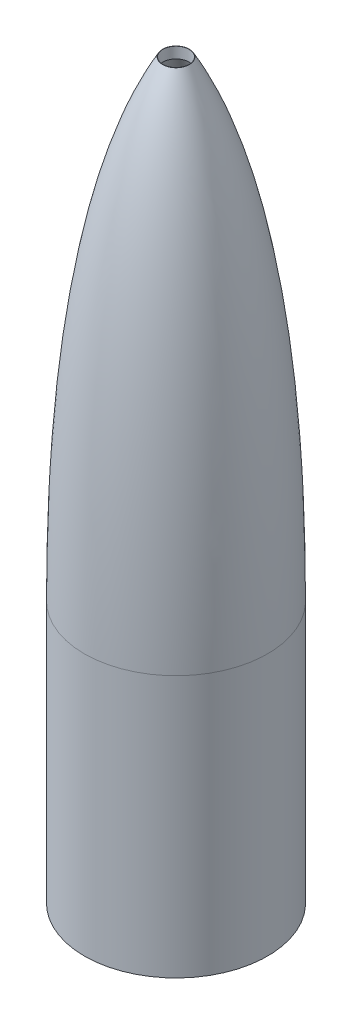
from build123d import *

# Parameters (mm, degrees)
SCHIZZO1_R                    = 17.5
ESTRUSIONE_ESTRUSIONE1_DEPTH  = 50
TAGLIO_ESTRUSIONE1_REACH      = 144.171
SCHIZZO10_R                   = 16.3
TAGLIO_ESTRUSIONE3_DEPTH      = 143.170672106
TAGLIO_ESTRUSIONE3_DEPTH_BACK = 143.170672106
SCHIZZO14_R                   = 2.5
SKETCH1_R                     = 16.3
SKETCH1_R_2                   = 14.8
BOSS_EXTRUDE3_DEPTH           = 15
BOSS_EXTRUDE4_DEPTH           = 5


with BuildPart() as part:
    # Schizzo1 → Estrusione-Estrusione1 (new body)
    with BuildSketch(Plane(origin=(0, 0, 0), x_dir=(1, 0, 0), z_dir=(0, 1, 0))):
        with Locations(Location((0, 0, 0), (0, 0, 270))):
            Circle(SCHIZZO1_R)
    extrude(amount=ESTRUSIONE_ESTRUSIONE1_DEPTH)

    # Schizzo7 → Rivoluzione1 (revolve)
    with BuildSketch(Plane.XY):
        with BuildLine():
            Line((0, 140), (-2.55, 140))
            add(Edge.make_bspline(
                [(-2.55, 140), (-17.5, 113.62789219), (-17.5, 50)],
                knots=[0, 0, 0, 1, 1, 1], degree=2))
            Line((-17.5, 50), (-16.3, 50))
            add(Edge.make_bspline(
                [(-2, 138.8), (-16.3, 113.62789219), (-16.3, 50)],
                knots=[0, 0, 0, 1, 1, 1], degree=2))
            Line((-2, 138.8), (0, 138.8))
            Line((0, 138.8), (0, 140))
        make_face()
    revolve(axis=Axis((0, 50, 0), (0, 1, 0)))

    # Schizzo10 → Taglio-Estrusione1 (cut, up to next)
    with BuildSketch(Plane(origin=(0, 0, 0), x_dir=(1, 0, 0), z_dir=(0, 1, 0)), mode=Mode.PRIVATE) as taglio_estrusione1_sk1:
        with Locations(Location((0, 0, 0), (0, 0, 90))):
            Circle(SCHIZZO10_R)
    taglio_estrusione1_tool1 = extrude(taglio_estrusione1_sk1.sketch, amount=TAGLIO_ESTRUSIONE1_REACH, mode=Mode.PRIVATE) & part.part
    add(taglio_estrusione1_tool1.solids().sort_by_distance((0, 0, 0))[0], mode=Mode.SUBTRACT)

    # Schizzo14 → Taglio-Estrusione3 (cut, two sides: drawn at the far end of the back side and taken through both)
    with BuildSketch(Plane(origin=(0, 140, 0), x_dir=(1, 0, 0), z_dir=(0, 1, 0)).offset(-TAGLIO_ESTRUSIONE3_DEPTH_BACK)):
        with Locations(Location((0, 0, 0), (0, 0, 90))):
            Circle(SCHIZZO14_R)
    extrude(amount=TAGLIO_ESTRUSIONE3_DEPTH + TAGLIO_ESTRUSIONE3_DEPTH_BACK, mode=Mode.SUBTRACT)

    # Sketch1 → Boss-Extrude3 (add)
    with BuildSketch(Plane.XZ):
        with Locations(Location((0, 0, 0), (0, 0, 270))):
            Circle(SKETCH1_R)
        with Locations(Location((0, 0, 0), (0, 0, 270))):
            Circle(SKETCH1_R_2, mode=Mode.SUBTRACT)
    extrude(amount=-BOSS_EXTRUDE3_DEPTH)

    # Sketch2 → Boss-Extrude4 (add)
    with BuildSketch(Plane.XZ):
        with BuildLine():
            ThreePointArc((-14.8, 0), (-14.688451314, -1.813669762), (-14.355486756, -3.6))
            Line((-14.355486756, -3.6), (-10.845070423, -3.6))
            ThreePointArc((-10.845070423, -3.6), (-8.29948601, -2.545584412), (-7.245070423, 0))
            Line((-7.245070423, 0), (-8.645070423, 0))
            ThreePointArc((-8.645070423, 0), (-10.845070423, -2.2), (-13.045070423, 0))
            Line((-13.045070423, 0), (-14.8, 0))
        make_face()
        with BuildLine():
            Line((-10.845070423, 3.6), (-14.355486756, 3.6))
            ThreePointArc((-14.355486756, 3.6), (-14.688451314, 1.813669762), (-14.8, 0))
            Line((-14.8, 0), (-13.045070423, 0))
            ThreePointArc((-13.045070423, 0), (-10.845070423, 2.2), (-8.645070423, 0))
            Line((-8.645070423, 0), (-7.245070423, 0))
            ThreePointArc((-7.245070423, 0), (-8.29948601, 2.545584412), (-10.845070423, 3.6))
        make_face()
        with BuildLine():
            ThreePointArc((8.645070423, 0), (10.845070423, 2.2), (13.045070423, 0))
            Line((13.045070423, 0), (14.8, 0))
            ThreePointArc((14.8, 0), (14.688451314, 1.813669762), (14.355486756, 3.6))
            Line((14.355486756, 3.6), (10.845070423, 3.6))
            ThreePointArc((10.845070423, 3.6), (8.29948601, 2.545584412), (7.245070423, 0))
            Line((7.245070423, 0), (8.645070423, 0))
        make_face()
        with BuildLine():
            Line((14.8, 0), (13.045070423, 0))
            ThreePointArc((13.045070423, 0), (10.845070423, -2.2), (8.645070423, 0))
            Line((8.645070423, 0), (7.245070423, 0))
            ThreePointArc((7.245070423, 0), (8.29948601, -2.545584412), (10.845070423, -3.6))
            Line((10.845070423, -3.6), (14.355486756, -3.6))
            ThreePointArc((14.355486756, -3.6), (14.688451314, -1.813669762), (14.8, 0))
        make_face()
    extrude(amount=-BOSS_EXTRUDE4_DEPTH)


solid = part.part
